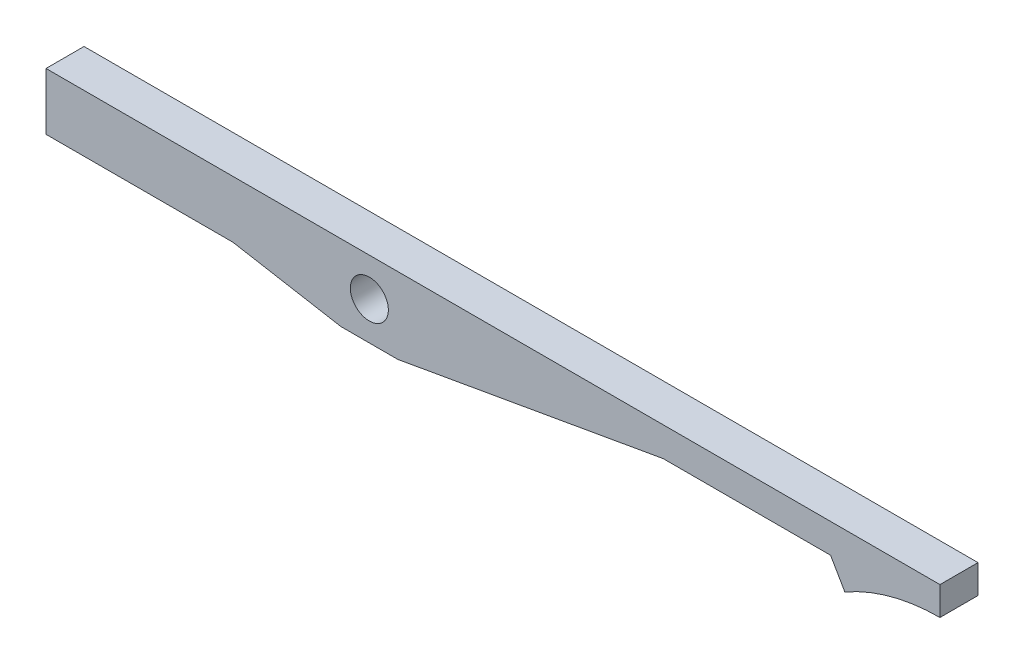
from build123d import *

# Parameters (mm, degrees)
SKICA1_R                = 1
P_IDAT_VYSUNUT_M1_DEPTH = 2


with BuildPart() as part:
    # Skica1 → Přidat vysunutím1 (new body)
    with BuildSketch(Plane.XY):
        with BuildLine():
            Line((0, 0), (0, -1.5))
            ThreePointArc((0, -1.5), (-2.588190451, -1.840741737), (-5, -2.839745962))
            Line((-5, -2.839745962), (-5.75, -1.540707856))
            Line((-5.75, -1.540707856), (-14.552661177, -1.540707856))
            Line((-14.552661177, -1.540707856), (-28.5, -4))
            Line((-28.5, -4), (-31.5, -4))
            Line((-31.5, -4), (-37.17128182, -3))
            Line((-37.17128182, -3), (-47, -3))
            Line((-47, -3), (-47, 0))
            Line((-47, 0), (0, 0))
        make_face()
        with Locations((-30, -2)):
            Circle(SKICA1_R, mode=Mode.SUBTRACT)
    extrude(amount=P_IDAT_VYSUNUT_M1_DEPTH)


solid = part.part
